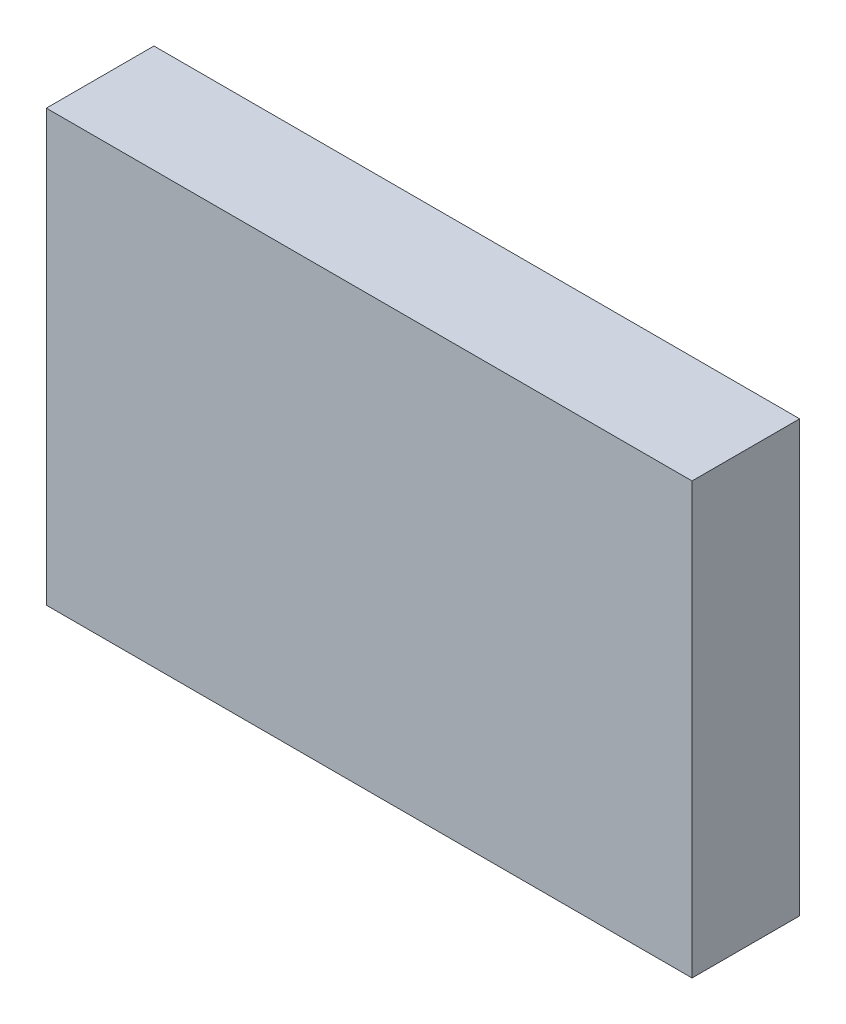
from build123d import *

# Parameters (mm, degrees)
SKETCH3_W           = 30
SKETCH3_H           = 20
BOSS_EXTRUDE1_DEPTH = 5


with BuildPart() as part:
    # Sketch3 → Boss-Extrude1 (new body)
    with BuildSketch(Plane.XY.offset(50)):
        Rectangle(SKETCH3_W, SKETCH3_H)
    extrude(amount=BOSS_EXTRUDE1_DEPTH)


solid = part.part
